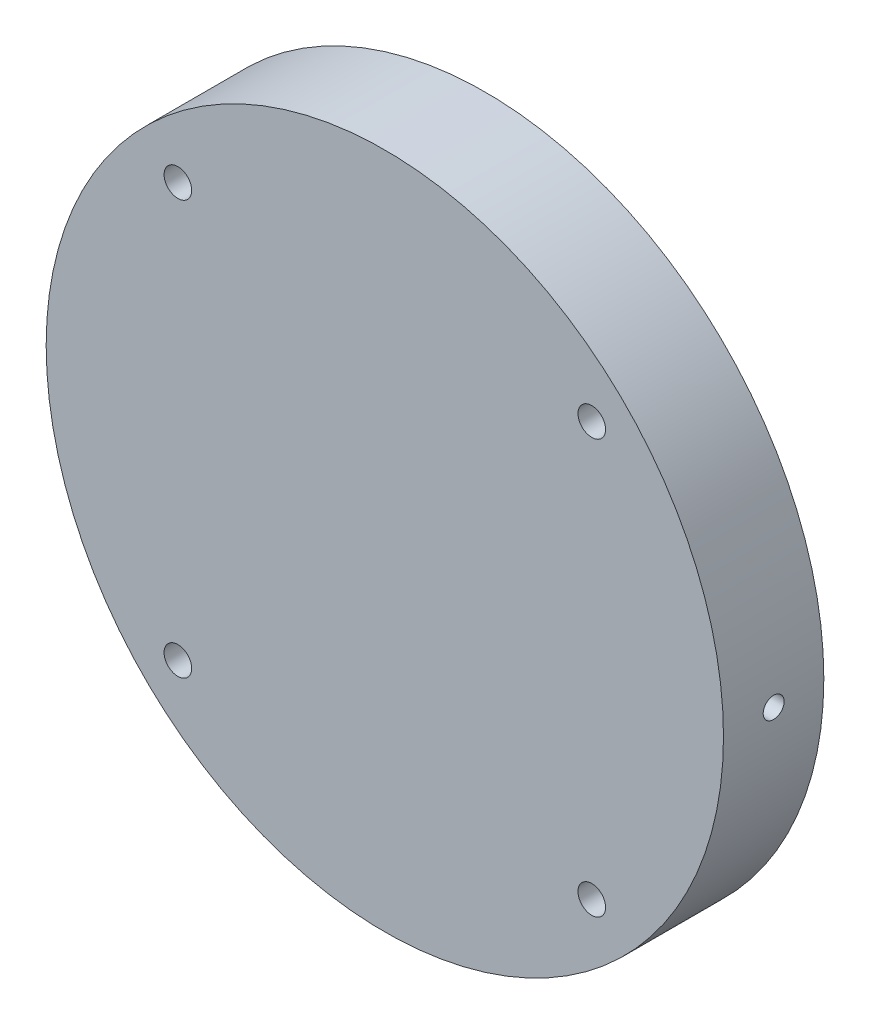
from build123d import *

# Parameters (mm, degrees)
SKETCH1_W                      = 40.5
SKETCH1_H                      = 12
F_2_5_2_5_DIAMETER_HOLE1_D     = 2.5
F_2_5_2_5_DIAMETER_HOLE1_DEPTH = 10
F_3_3_3_3_DIAMETER_HOLE1_D     = 3.3
F_3_3_3_3_DIAMETER_HOLE1_DEPTH = 8


with BuildPart() as part:
    # Sketch1 → Revolve1 (revolve)
    with BuildSketch(Plane.XZ, mode=Mode.PRIVATE) as revolve1_sk:
        with Locations((20.25, 6)):
            Rectangle(SKETCH1_W, SKETCH1_H)
    revolve(revolve1_sk.sketch.rotate(Axis((0, 0, 12), (0, 0, -1)), 180), axis=Axis((0, 0, 12), (0, 0, -1)))

    # Ø2.5 (2.5) Diameter Hole1
    with Locations(Plane(origin=(40.5, 0, 6), x_dir=(0, 1, 0), z_dir=(1, 0, 0))):
        with Locations((0, 0)):
            Hole(F_2_5_2_5_DIAMETER_HOLE1_D / 2, depth=F_2_5_2_5_DIAMETER_HOLE1_DEPTH)

    # Ø3.3 (3.3) Diameter Hole1
    with Locations(Plane.XY.offset(12)):
        with Locations((24.748737342, 24.748737342), (-24.748737342, 24.748737342), (24.748737342, -24.748737342), (-24.748737342, -24.748737342)):
            Hole(F_3_3_3_3_DIAMETER_HOLE1_D / 2, depth=F_3_3_3_3_DIAMETER_HOLE1_DEPTH)


solid = part.part
